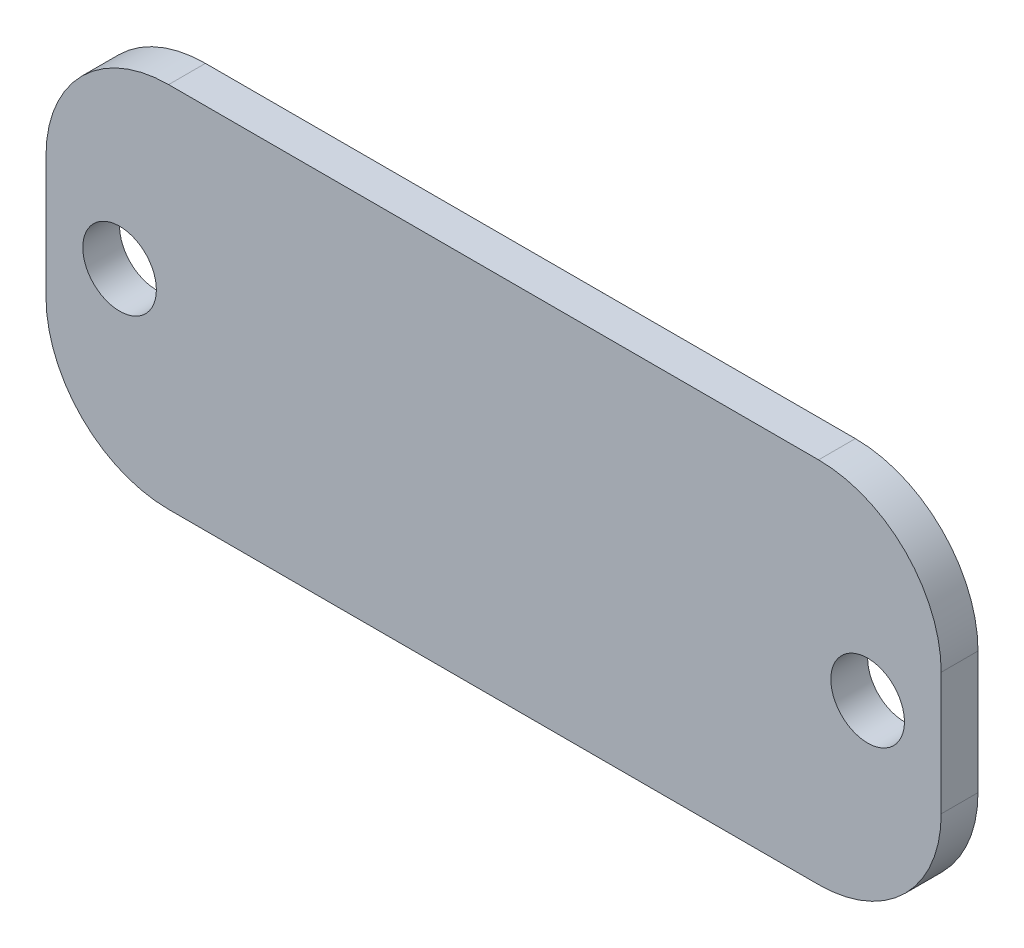
from build123d import *

# Parameters (mm, degrees)
SKETCH_3_R      = 3
EXTRUDE_1_DEPTH = 3


with BuildPart() as part:
    # 草图3 → 凸台-拉伸1 (new body)
    with BuildSketch(Plane.XY):
        with BuildLine():
            Line((10, 0), (63, 0))
            ThreePointArc((63, 0), (70.071067812, 2.928932188), (73, 10))
            Line((73, 10), (73, 20))
            ThreePointArc((73, 20), (70.071067812, 27.071067812), (63, 30))
            Line((63, 30), (10, 30))
            ThreePointArc((10, 30), (2.928932188, 27.071067812), (0, 20))
            Line((0, 20), (0, 10))
            ThreePointArc((0, 10), (2.928932188, 2.928932188), (10, 0))
        make_face()
        with Locations((6, 15)):
            Circle(SKETCH_3_R, mode=Mode.SUBTRACT)
        with Locations(Location((67, 15, 0), (0, 0, 180))):
            Circle(SKETCH_3_R, mode=Mode.SUBTRACT)
    extrude(amount=EXTRUDE_1_DEPTH)


solid = part.part
